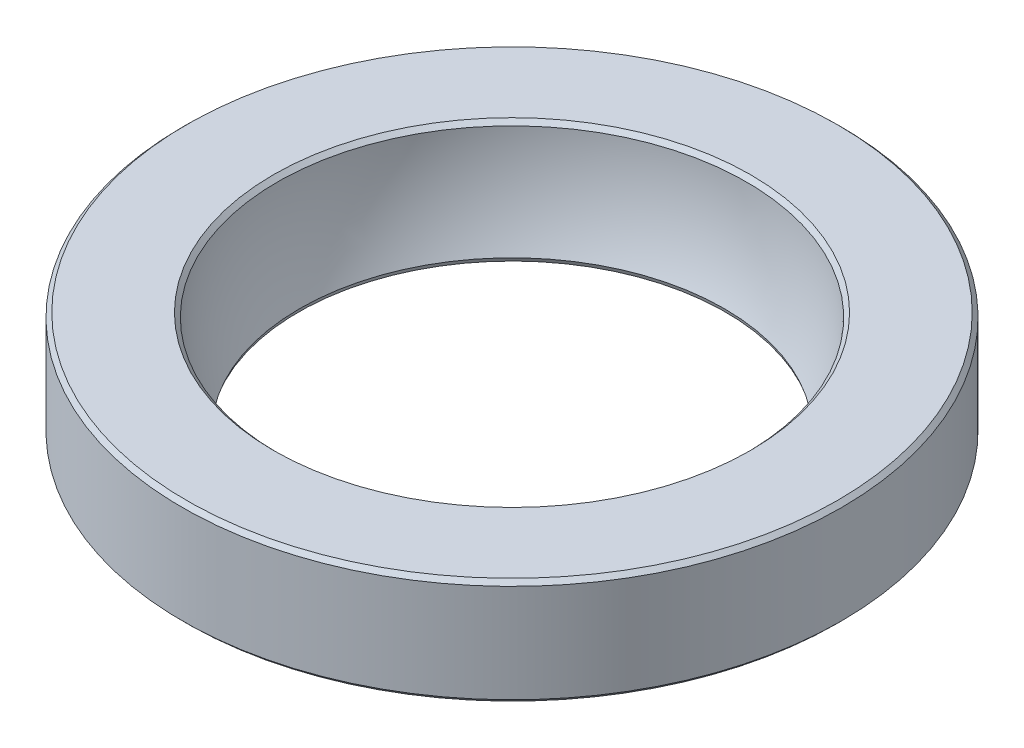
from build123d import *
from OCP.BRepFilletAPI import BRepFilletAPI_MakeChamfer

# Parameters (mm, degrees)
CUT_EXTRUDE1_DEPTH      = 18.407344018
CUT_EXTRUDE1_DEPTH_BACK = 18.407344018
SKETCH3_W               = 25.396980305
SKETCH3_H               = 7.254542424
CHAMFER1_SIZE           = 0.15
CHAMFER1_SIZE2          = 0.112518034


with BuildPart() as part:
    # Sketch2 → Revolve1 (revolve)
    with BuildSketch(Plane.XY):
        with BuildLine():
            Line((-7.664872763, -3.875), (-12, -3.875))
            Line((-12, -3.875), (-12, 3.875))
            Line((-12, 3.875), (-7.664872763, 3.875))
            ThreePointArc((-7.664872763, 3.875), (-8.541796068, 0), (-7.664872763, -3.875))
        make_face()
    revolve(axis=Axis((0, 6, 0), (0, -1, 0)))

    # Sketch3 → Cut-Extrude1 (cut, two sides: drawn at the far end of the back side and taken through both)
    with BuildSketch(Plane.XY.offset(-CUT_EXTRUDE1_DEPTH_BACK)):
        with Locations((0.698490153, 3.627271212)):
            Rectangle(SKETCH3_W, SKETCH3_H)
    extrude(amount=CUT_EXTRUDE1_DEPTH + CUT_EXTRUDE1_DEPTH_BACK, mode=Mode.SUBTRACT)

    # Chamfer1: one chamfer whose edges measure the first distance from different faces: ONE call of the kernel's chamfer builder (chamfer() names one face for all edges)
    chamfer1_edges_1 = [part.edges().sort_by_distance(p)[0] for p in [
        (12, 0, 0),
        (8.541796068, 0, -5e-09),
        (12, -3.875, 0),
    ]]
    chamfer1_edges_2 = [part.edges().sort_by_distance(p)[0] for p in [
        (7.664872763, -3.875, 0),
    ]]
    chamfer1_side_2 = [part.faces().sort_by_distance(p)[0] for p in [
        (8.31982803, -1.986493109, 0),
    ]]
    chamfer1 = BRepFilletAPI_MakeChamfer(part.part.solid().wrapped)
    for e in chamfer1_edges_1:
        chamfer1.Add(CHAMFER1_SIZE, e.wrapped)
    for e in chamfer1_edges_2:
        chamfer1.Add(CHAMFER1_SIZE, CHAMFER1_SIZE2, e.wrapped, chamfer1_side_2[0].wrapped)  # the first distance lies on this face
    add(Compound.cast(chamfer1.Shape()), mode=Mode.REPLACE)


solid = part.part
